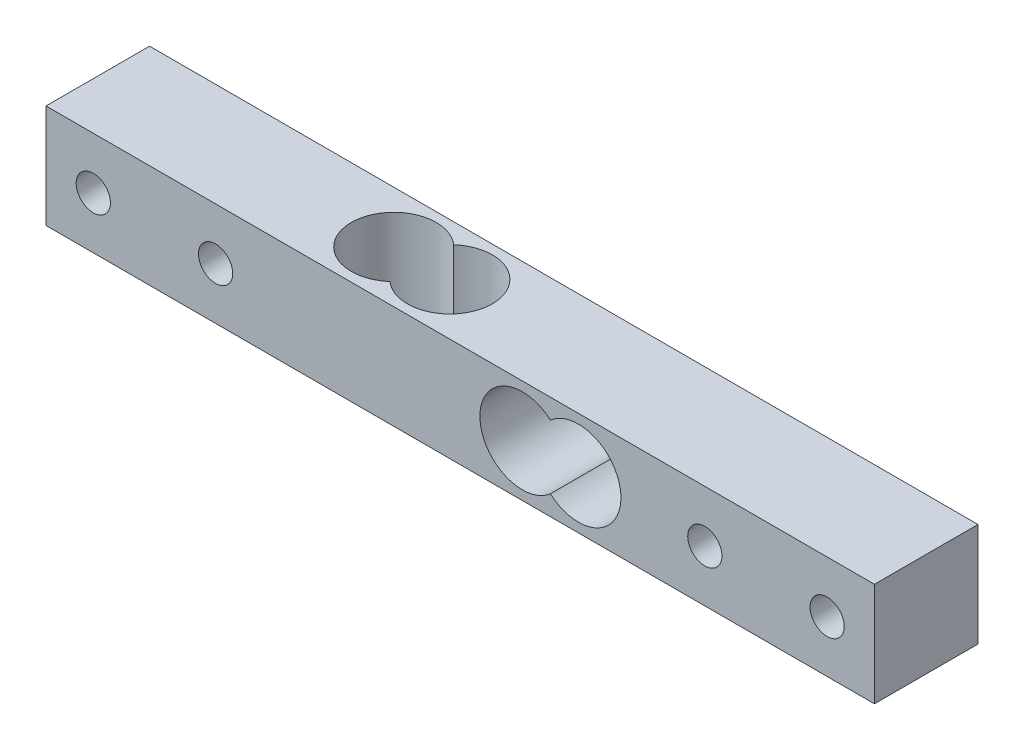
from build123d import *

# Parameters (mm, degrees)
SKETCH1_W                 = 12.7
SKETCH1_H                 = 12.7
BOSS_EXTRUDE1_DEPTH       = 50.8
SKETCH2_R                 = 5.21
CUT_EXTRUDE1_DEPTH        = 101.6
SKETCH3_R                 = 5.21
CUT_EXTRUDE2_DEPTH        = 101.6
M5X0_8_TAPPED_HOLE2_D     = 4.2
M5X0_8_TAPPED_HOLE2_DEPTH = 14
M5X0_8_TAPPED_HOLE2_TIP   = 1.2618073


with BuildPart() as part:
    # Sketch1 → Boss-Extrude1 (new, symmetric)
    with BuildSketch(Plane(origin=(0, 0, 0), x_dir=(0, 0, -1), z_dir=(1, 0, 0))):
        Rectangle(SKETCH1_W, SKETCH1_H)
    extrude(amount=BOSS_EXTRUDE1_DEPTH, both=True)

    # Sketch2 → Cut-Extrude1 (cut)
    with BuildSketch(Plane(origin=(0, 6.35, 0), x_dir=(1, 0, 0), z_dir=(0, 1, 0))):
        with Locations((-7.62, 0)):
            Circle(SKETCH2_R)
        with Locations((-14.5, 0)):
            Circle(SKETCH2_R)
    extrude(amount=-CUT_EXTRUDE1_DEPTH, mode=Mode.SUBTRACT)

    # Sketch3 → Cut-Extrude2 (cut)
    with BuildSketch(Plane(origin=(0, 0, -6.35), x_dir=(-1, 0, 0), z_dir=(0, 0, -1))):
        with Locations((-14.5, 0)):
            Circle(SKETCH3_R)
        with Locations((-7.62, 0)):
            Circle(SKETCH3_R)
    extrude(amount=-CUT_EXTRUDE2_DEPTH, mode=Mode.SUBTRACT)

    # M5x0.8 Tapped Hole2
    with Locations(Plane(origin=(0, 0, -6.35), x_dir=(-1, 0, 0), z_dir=(0, 0, -1))):
        with Locations((-45, 0), (-30, 0), (30, 0), (45, 0)):
            Hole(M5X0_8_TAPPED_HOLE2_D / 2, depth=M5X0_8_TAPPED_HOLE2_DEPTH)
            with Locations((0, 0, -(M5X0_8_TAPPED_HOLE2_DEPTH + M5X0_8_TAPPED_HOLE2_TIP / 2))):  # 118° drill point
                Cone(0, M5X0_8_TAPPED_HOLE2_D / 2, M5X0_8_TAPPED_HOLE2_TIP, mode=Mode.SUBTRACT)


solid = part.part
